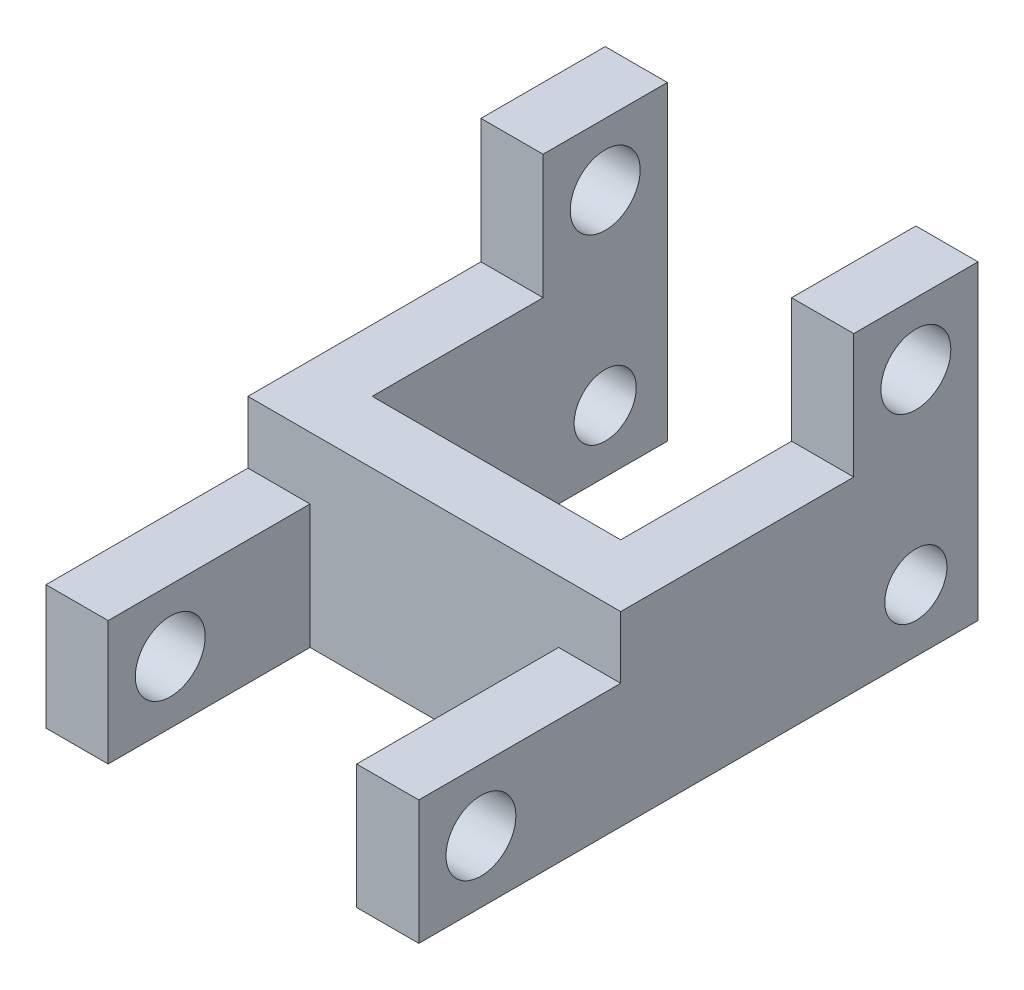
from build123d import *

# Parameters (mm, degrees)
SKETCH1_W           = 82.55
SKETCH1_H           = 76.2
SKETCH1_R           = 14.2875
SKETCH1_W_2         = 25.4
SKETCH1_R_2         = 12.7
BOSS_EXTRUDE1_DEPTH = 25.4
SKETCH1_3_W         = 25.4
SKETCH1_3_H         = 76.2
BOSS_EXTRUDE2_DEPTH = 101.6
BOSS_EXTRUDE4_START = -127
SKETCH1_4_W         = 25.4
SKETCH1_4_H         = 76.2
SKETCH1_4_R         = 12.7
SKETCH1_4_R_2       = 14.2875
SKETCH1_4_W_2       = 82.55
BOSS_EXTRUDE4_DEPTH = 25.4
SKETCH2_W           = 82.55
SKETCH2_H           = 25.4
CUT_EXTRUDE1_DEPTH  = 274.566372202


with BuildPart() as part:
    # Sketch1 → Boss-Extrude1 (new body)
    # profile 1 of 3: a face of its own
    with BuildSketch(Plane(origin=(0, 0, 0), x_dir=(0, 0, -1), z_dir=(1, 0, 0))):
        with Locations((15.875, 12.7)):
            Rectangle(SKETCH1_W, SKETCH1_H)
        Circle(SKETCH1_R, mode=Mode.SUBTRACT)
    # profile 2 of 3: a face of its own
    with BuildSketch(Plane(origin=(0, 0, 0), x_dir=(0, 0, -1), z_dir=(1, 0, 0))):
        with Locations((69.85, 12.7)):
            Rectangle(SKETCH1_W_2, SKETCH1_H)
    # profile 3 of 3: a face of its own
    with BuildSketch(Plane(origin=(0, 0, 0), x_dir=(0, 0, -1), z_dir=(1, 0, 0))):
        Polygon((82.55, 50.8), (82.55, -25.4), (203.2, -25.4), (203.2, 101.6), (152.4, 101.6), (152.4, 50.8), align=None)
        with Locations((177.8, 0)):
            Circle(SKETCH1_R_2, mode=Mode.SUBTRACT)
        with Locations((177.8, 76.2)):
            Circle(SKETCH1_R, mode=Mode.SUBTRACT)
    extrude(amount=BOSS_EXTRUDE1_DEPTH)

    # Sketch1<3> → Boss-Extrude2 (add)
    with BuildSketch(Plane(origin=(0, 0, 0), x_dir=(0, 0, -1), z_dir=(1, 0, 0))):
        with Locations((69.85, 12.7)):
            Rectangle(SKETCH1_3_W, SKETCH1_3_H)
    extrude(amount=-BOSS_EXTRUDE2_DEPTH)

    # Sketch1<4> → Boss-Extrude4 (add)
    # profile 1 of 3: a face of its own
    with BuildSketch(Plane(origin=(0, 0, 0), x_dir=(0, 0, -1), z_dir=(1, 0, 0)).offset(BOSS_EXTRUDE4_START)):
        with Locations((69.85, 12.7)):
            Rectangle(SKETCH1_4_W, SKETCH1_4_H)
    # profile 2 of 3: a face of its own
    with BuildSketch(Plane(origin=(0, 0, 0), x_dir=(0, 0, -1), z_dir=(1, 0, 0)).offset(BOSS_EXTRUDE4_START)):
        Polygon((82.55, 50.8), (82.55, -25.4), (203.2, -25.4), (203.2, 101.6), (152.4, 101.6), (152.4, 50.8), align=None)
        with Locations((177.8, 0)):
            Circle(SKETCH1_4_R, mode=Mode.SUBTRACT)
        with Locations((177.8, 76.2)):
            Circle(SKETCH1_4_R_2, mode=Mode.SUBTRACT)
    # profile 3 of 3: a face of its own
    with BuildSketch(Plane(origin=(0, 0, 0), x_dir=(0, 0, -1), z_dir=(1, 0, 0)).offset(BOSS_EXTRUDE4_START)):
        with Locations((15.875, 12.7)):
            Rectangle(SKETCH1_4_W_2, SKETCH1_4_H)
        Circle(SKETCH1_4_R_2, mode=Mode.SUBTRACT)
    extrude(amount=BOSS_EXTRUDE4_DEPTH)

    # Sketch2 → Cut-Extrude1 (cut, through all)
    with BuildSketch(Plane(origin=(25.4, 0, 0), x_dir=(0, 0, -1), z_dir=(1, 0, 0))):
        with Locations((15.875, 38.1)):
            Rectangle(SKETCH2_W, SKETCH2_H)
    extrude(amount=-CUT_EXTRUDE1_DEPTH, mode=Mode.SUBTRACT)


solid = part.part
